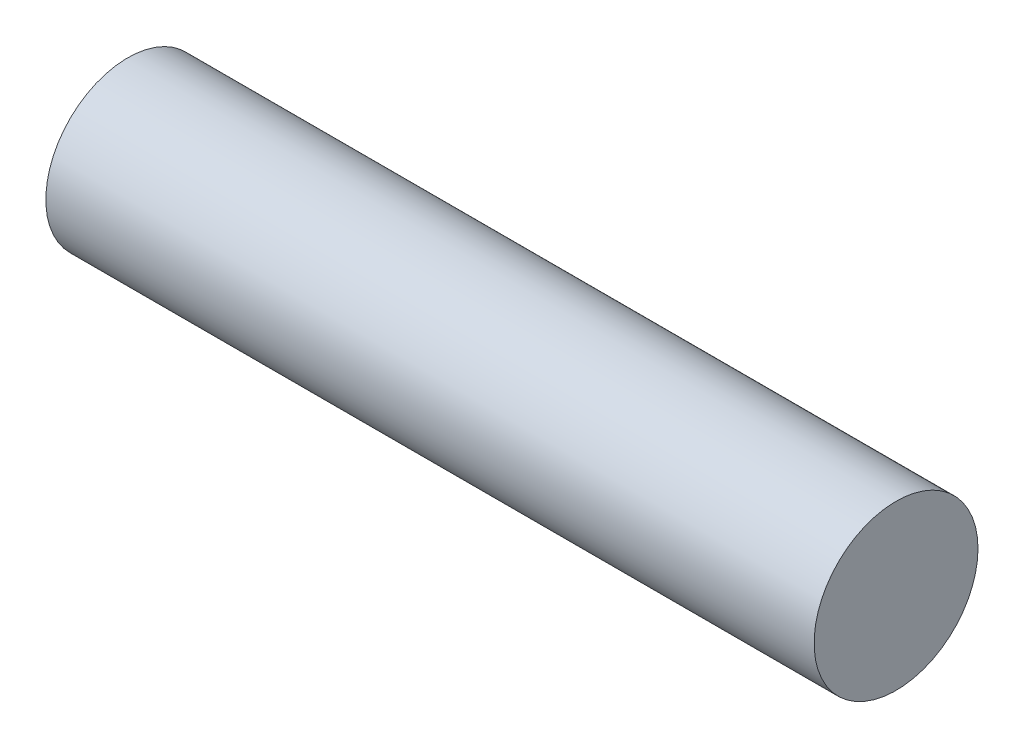
from build123d import *

# Parameters (mm, degrees)
SKETCH1_R           = 1.6
BOSS_EXTRUDE1_DEPTH = 7.5


with BuildPart() as part:
    # Sketch1 → Boss-Extrude1 (new, symmetric)
    with BuildSketch(Plane(origin=(0, 0, 0), x_dir=(0, 0, -1), z_dir=(1, 0, 0))):
        Circle(SKETCH1_R)
    extrude(amount=BOSS_EXTRUDE1_DEPTH, both=True)


solid = part.part
